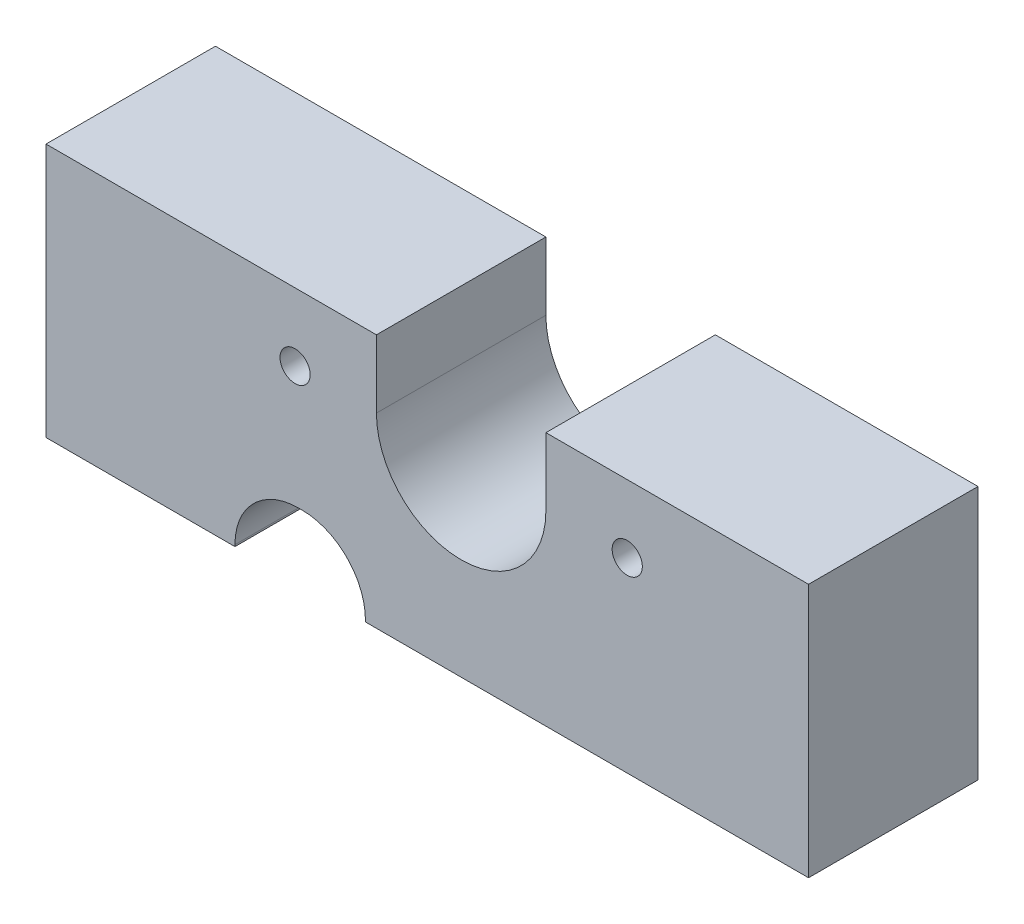
from build123d import *

# Parameters (mm, degrees)
SKETCH1_W                       = 12.7
SKETCH1_H                       = 19.05
BOSS_EXTRUDE1_DEPTH             = 57.15
F_6_32_TAPPED_HOLE1_D           = 2.7051
F_6_32_TAPPED_HOLE1_DEPTH       = 12.7
F_6_32_TAPPED_HOLE1_CBORE_D     = 3.5052
F_6_32_TAPPED_HOLE1_CBORE_DEPTH = 10.795
F_6_32_TAPPED_HOLE1_TIP         = 0.81269403
CUT_EXTRUDE2_DEPTH              = 62.565534189
F_4_40_TAPPED_HOLE1_D           = 2.2606
CUT_EXTRUDE3_DEPTH              = 62.565534189


with BuildPart() as part:
    # Sketch1 → Boss-Extrude1 (new body)
    with BuildSketch(Plane(origin=(0, 0, 0), x_dir=(0, 0, -1), z_dir=(1, 0, 0))):
        with Locations((6.35, 9.525)):
            Rectangle(SKETCH1_W, SKETCH1_H)
    extrude(amount=-BOSS_EXTRUDE1_DEPTH)

    # #6-32 Tapped Hole1
    with Locations(Plane(origin=(23.287154444, 0, 3.188270264), x_dir=(1, 0, 0), z_dir=(0, -1, 0))):
        with Locations((-29.637154444, -9.538270264), (-74.087154444, -9.538270264)):
            CounterBoreHole(F_6_32_TAPPED_HOLE1_D / 2, F_6_32_TAPPED_HOLE1_CBORE_D / 2, F_6_32_TAPPED_HOLE1_CBORE_DEPTH, depth=F_6_32_TAPPED_HOLE1_DEPTH)
            with Locations((0, 0, -(F_6_32_TAPPED_HOLE1_DEPTH + F_6_32_TAPPED_HOLE1_TIP / 2))):  # 118° drill point
                Cone(0, F_6_32_TAPPED_HOLE1_D / 2, F_6_32_TAPPED_HOLE1_TIP, mode=Mode.SUBTRACT)

    # Sketch5 → Cut-Extrude2 (cut, through all)
    with BuildSketch(Plane(origin=(0, 0, -12.7), x_dir=(-1, 0, 0), z_dir=(0, 0, -1))):
        with BuildLine():
            Line((32.385, 19.05), (32.385, 13.97))
            ThreePointArc((32.385, 13.97), (26.035, 7.62), (19.685, 13.97))
            Line((19.685, 13.97), (19.685, 19.05))
            ThreePointArc((19.685, 19.05), (26.035, 25.4), (32.385, 19.05))
        make_face()
    extrude(amount=-CUT_EXTRUDE2_DEPTH, mode=Mode.SUBTRACT)

    # #4-40 Tapped Hole1 (through all)
    with Locations(Plane(origin=(0, 0, -12.7), x_dir=(-1, 0, 0), z_dir=(0, 0, -1))):
        with Locations((13.589, 13.97), (38.481, 13.97)):
            Hole(F_4_40_TAPPED_HOLE1_D / 2)

    # Sketch6 → Cut-Extrude3 (cut, through all)
    with BuildSketch(Plane(origin=(0, 0, -12.7), x_dir=(-1, 0, 0), z_dir=(0, 0, -1))):
        with BuildLine():
            Line((33.2105, 0), (42.9895, 0))
            Line((42.9895, 0), (42.9895, 0.127))
            ThreePointArc((42.9895, 0.127), (41.594596045, 3.494596045), (38.227, 4.8895))
            Line((38.227, 4.8895), (37.973, 4.8895))
            ThreePointArc((37.973, 4.8895), (34.605403955, 3.494596045), (33.2105, 0.127))
            Line((33.2105, 0.127), (33.2105, 0))
        make_face()
    extrude(amount=-CUT_EXTRUDE3_DEPTH, mode=Mode.SUBTRACT)


solid = part.part
